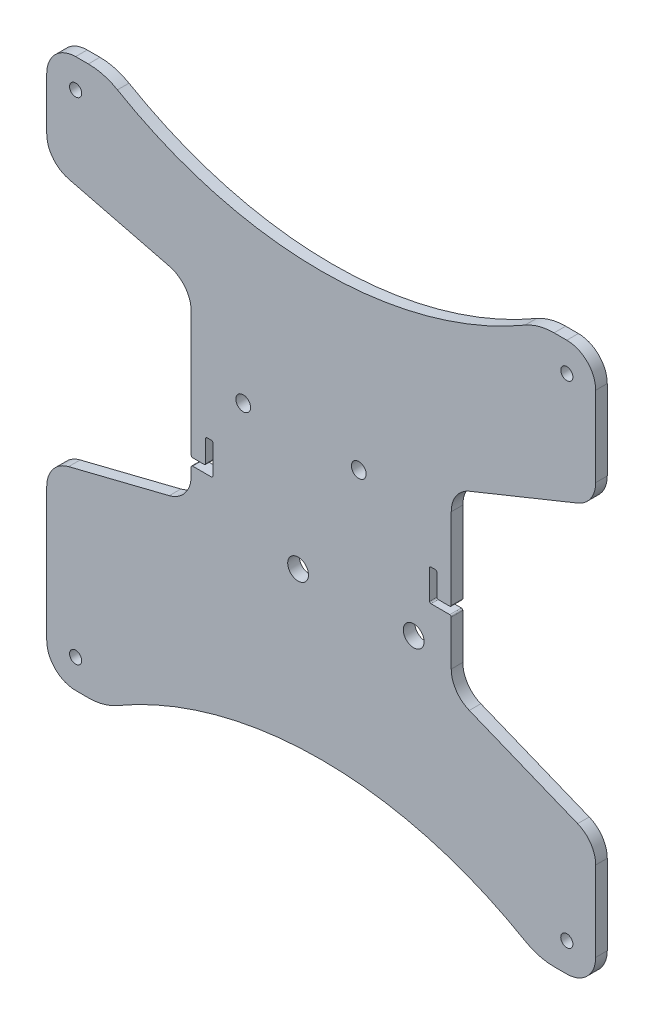
from build123d import *

# Parameters (mm, degrees)
SKETCH1_R           = 2.55
SKETCH1_R_2         = 3.6
SKETCH1_R_3         = 2.1
BOSS_EXTRUDE1_DEPTH = 4


with BuildPart() as part:
    # Sketch1 → Boss-Extrude1 (new body)
    with BuildSketch(Plane.XY.offset(4)):
        with BuildLine():
            Line((-45, -8), (-45, -10.692235936))
            ThreePointArc((-45, -10.692235936), (-47.11794562, -16.84635803), (-52.57464375, -20.393660937))
            Line((-52.57464375, -20.393660937), (-87.42535625, -29.106339063))
            ThreePointArc((-87.42535625, -29.106339063), (-92.88205438, -32.65364197), (-95, -38.807764064))
            Line((-95, -38.807764064), (-95, -85))
            ThreePointArc((-95, -85), (-92.071067812, -92.071067812), (-85, -95))
            Line((-85, -95), (-80.600023778, -95))
            ThreePointArc((-80.600023778, -95), (-75.38177505, -94.307249421), (-70.525020806, -92.276988022))
            ThreePointArc((-70.525020806, -92.276988022), (0, -73.215904175), (70.525020806, -92.276988022))
            ThreePointArc((70.525020806, -92.276988022), (75.38177505, -94.307249421), (80.600023778, -95))
            Line((80.600023778, -95), (85, -95))
            ThreePointArc((85, -95), (92.071067812, -92.071067812), (95, -85))
            Line((95, -85), (95, -57.30993956))
            ThreePointArc((95, -57.30993956), (93.292887614, -51.721736358), (88.754396995, -48.041471336))
            Line((88.754396995, -48.041471336), (51.245603005, -32.847708996))
            ThreePointArc((51.245603005, -32.847708996), (46.707112386, -29.167443975), (45, -23.579240773))
            Line((45, -23.579240773), (45, -8))
            ThreePointArc((45, -8), (44.853553391, -7.646446609), (44.5, -7.5))
            Line((44.5, -7.5), (38, -7.5))
            ThreePointArc((38, -7.5), (37.646446609, -7.353553391), (37.5, -7))
            Line((37.5, -7), (37.5, 3))
            ThreePointArc((37.5, 3), (37.646446609, 3.353553391), (38, 3.5))
            Line((38, 3.5), (39.5, 3.5))
            ThreePointArc((39.5, 3.5), (39.853553391, 3.353553391), (40, 3))
            Line((40, 3), (40, -4.5))
            ThreePointArc((40, -4.5), (40.146446609, -4.853553391), (40.5, -5))
            Line((40.5, -5), (44.5, -5))
            ThreePointArc((44.5, -5), (44.853553391, -4.853553391), (45, -4.5))
            Line((45, -4.5), (45, 23.579240773))
            ThreePointArc((45, 23.579240773), (46.707112386, 29.167443975), (51.245603005, 32.847708996))
            Line((51.245603005, 32.847708996), (88.754396995, 48.041471336))
            ThreePointArc((88.754396995, 48.041471336), (93.292887614, 51.721736358), (95, 57.30993956))
            Line((95, 57.30993956), (95, 85))
            ThreePointArc((95, 85), (92.071067812, 92.071067812), (85, 95))
            Line((85, 95), (80.600023778, 95))
            ThreePointArc((80.600023778, 95), (75.38177505, 94.307249421), (70.525020806, 92.276988022))
            ThreePointArc((70.525020806, 92.276988022), (0, 73.215904175), (-70.525020806, 92.276988022))
            ThreePointArc((-70.525020806, 92.276988022), (-75.38177505, 94.307249421), (-80.600023778, 95))
            Line((-80.600023778, 95), (-85, 95))
            ThreePointArc((-85, 95), (-92.071067812, 92.071067812), (-95, 85))
            Line((-95, 85), (-95, 66.807764064))
            ThreePointArc((-95, 66.807764064), (-92.88205438, 60.65364197), (-87.42535625, 57.106339063))
            Line((-87.42535625, 57.106339063), (-52.57464375, 48.393660937))
            ThreePointArc((-52.57464375, 48.393660937), (-47.11794562, 44.84635803), (-45, 38.692235936))
            Line((-45, 38.692235936), (-45, -4.5))
            ThreePointArc((-45, -4.5), (-44.853553391, -4.853553391), (-44.5, -5))
            Line((-44.5, -5), (-40.5, -5))
            ThreePointArc((-40.5, -5), (-40.146446609, -4.853553391), (-40, -4.5))
            Line((-40, -4.5), (-40, 3))
            ThreePointArc((-40, 3), (-39.853553391, 3.353553391), (-39.5, 3.5))
            Line((-39.5, 3.5), (-38, 3.5))
            ThreePointArc((-38, 3.5), (-37.646446609, 3.353553391), (-37.5, 3))
            Line((-37.5, 3), (-37.5, -7))
            ThreePointArc((-37.5, -7), (-37.646446609, -7.353553391), (-38, -7.5))
            Line((-38, -7.5), (-44.5, -7.5))
            ThreePointArc((-44.5, -7.5), (-44.853553391, -7.646446609), (-45, -8))
        make_face()
        with Locations(Location((13, 20.1, 0), (0, 0, 180))):
            Circle(SKETCH1_R, mode=Mode.SUBTRACT)
        with Locations(Location((32, -20.1, 0), (0, 0, 180))):
            Circle(SKETCH1_R_2, mode=Mode.SUBTRACT)
        with Locations(Location((-8, -20.1, 0), (0, 0, 180))):
            Circle(SKETCH1_R_2, mode=Mode.SUBTRACT)
        with Locations(Location((-27, 20.1, 0), (0, 0, 180))):
            Circle(SKETCH1_R, mode=Mode.SUBTRACT)
        with Locations(Location((-85, 85, 0), (0, 0, 180))):
            Circle(SKETCH1_R_3, mode=Mode.SUBTRACT)
        with Locations(Location((85, 85, 0), (0, 0, 180))):
            Circle(SKETCH1_R_3, mode=Mode.SUBTRACT)
        with Locations(Location((-85, -85, 0), (0, 0, 180))):
            Circle(SKETCH1_R_3, mode=Mode.SUBTRACT)
        with Locations(Location((85, -85, 0), (0, 0, 180))):
            Circle(SKETCH1_R_3, mode=Mode.SUBTRACT)
    extrude(amount=-BOSS_EXTRUDE1_DEPTH)


solid = part.part
